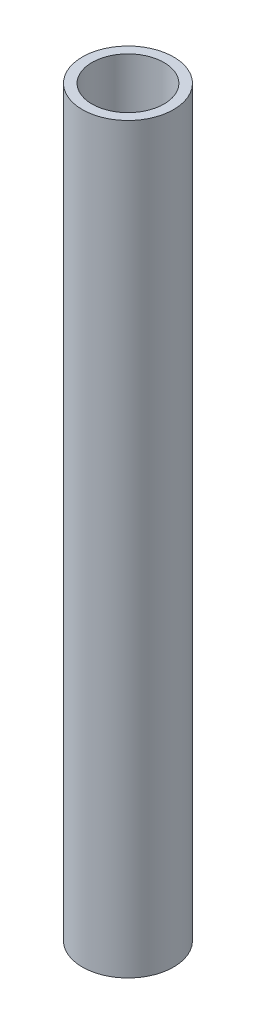
from build123d import *

# Parameters (mm, degrees)
SKETCH1_R           = 24.13
SKETCH1_R_2         = 19.05
BOSS_EXTRUDE1_DEPTH = 196.342


with BuildPart() as part:
    # Sketch1 → Boss-Extrude1 (new, symmetric)
    with BuildSketch(Plane(origin=(0, 0, 0), x_dir=(1, 0, 0), z_dir=(0, 1, 0))):
        with Locations(Location((0, 0, 0), (0, 0, 270))):
            Circle(SKETCH1_R)
        with Locations(Location((0, 0, 0), (0, 0, 270))):
            Circle(SKETCH1_R_2, mode=Mode.SUBTRACT)
    extrude(amount=BOSS_EXTRUDE1_DEPTH, both=True)


solid = part.part
